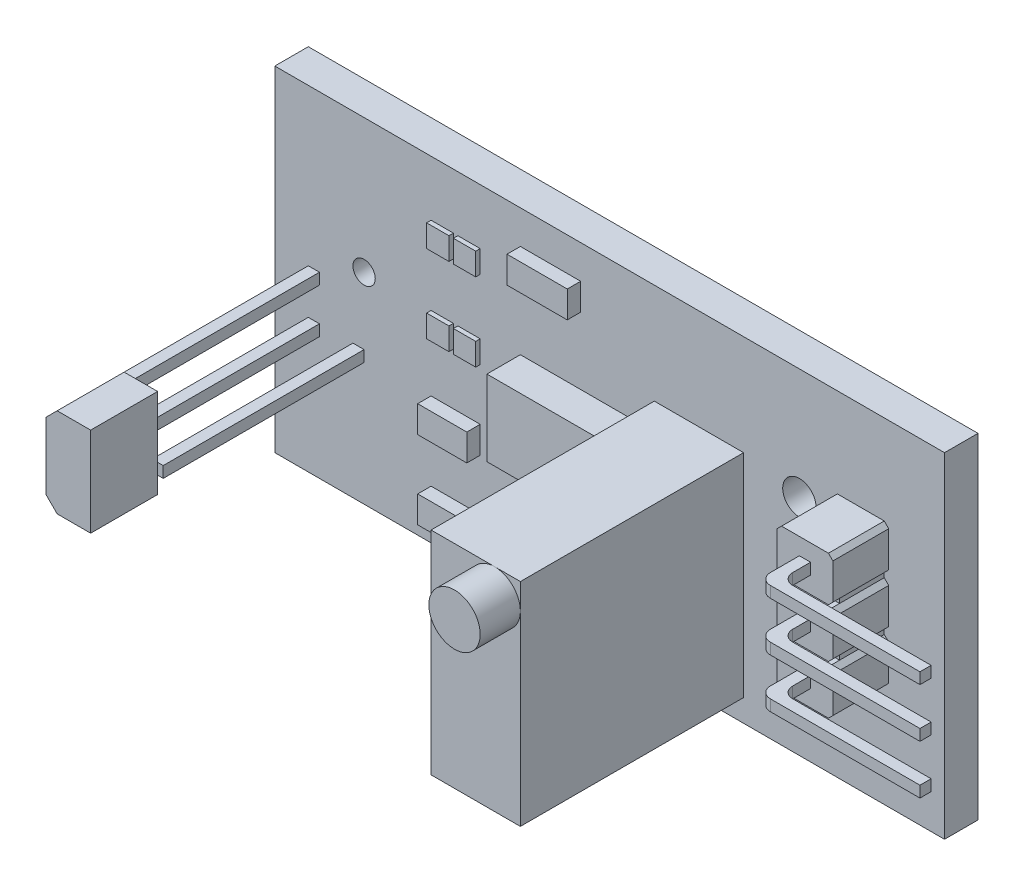
from build123d import *

# Parameters (mm, degrees)
SKETCH_1_W          = 30
SKETCH_1_H          = 15
EXTRUDE_1_DEPTH     = 1.5
SKETCH_2_W          = 4
SKETCH_2_H          = 9.5
EXTRUDE_2_DEPTH     = 10
SKETCH_3_R          = 1.15
EXTRUDE_3_DEPTH     = 1.8
SKETCH_5_W          = 2.5
SKETCH_5_H          = 2
EXTRUDE_4_DEPTH     = 2.5
CHAMFER_1_SIZE      = 0.2
SKETCH_6_W          = 2.1
SKETCH_6_H          = 0.2
EXTRUDE_5_DEPTH     = 2
SKETCH_7_W          = 0.5
SKETCH_7_H          = 0.5
EXTRUDE_6_DEPTH     = 1.8
SKETCH_8_W          = 0.5
SKETCH_8_H          = 0.5
EXTRUDE_7_DEPTH     = 6.7
FILLET_1_R          = 0.5
SKETCH_10_R         = 0.747999162
CUT_EXTRUDE_1_DEPTH = 39.294647146
SKETCH_11_W         = 5
SKETCH_11_H         = 3.4
EXTRUDE_8_DEPTH     = 1.5
SKETCH_12_W         = 2.7
SKETCH_12_H         = 1.2
EXTRUDE_9_DEPTH     = 0.6
SKETCH_13_W         = 1.6
SKETCH_13_H         = 1.3
EXTRUDE_10_DEPTH    = 1
SKETCH_14_W         = 1
SKETCH_14_H         = 1
EXTRUDE_11_DEPTH    = 0.2
SKETCH_15_W         = 2.2
SKETCH_15_H         = 1.2
EXTRUDE_12_DEPTH    = 0.6
SKETCH_17_R         = 0.5
CUT_EXTRUDE_2_DEPTH = 39.294647146
SKETCH_18_W         = 0.5
SKETCH_18_H         = 0.5
EXTRUDE_13_DEPTH    = 9
SKETCH_20_W         = 2
SKETCH_20_H         = 4
EXTRUDE_14_DEPTH    = 3
CHAMFER_2_SIZE      = 0.5


with BuildPart() as part:
    # 草图1 → 凸台-拉伸1 (new body)
    with BuildSketch(Plane.XY):
        with Locations((15, 7.5)):
            Rectangle(SKETCH_1_W, SKETCH_1_H)
    extrude(amount=EXTRUDE_1_DEPTH)

    # 草图2 → 凸台-拉伸2 (add)
    with BuildSketch(Plane.XY.offset(1.5)):
        with Locations((19, 5.75)):
            Rectangle(SKETCH_2_W, SKETCH_2_H)
    extrude(amount=EXTRUDE_2_DEPTH)

    # 草图3 → 凸台-拉伸3 (add)
    with BuildSketch(Plane.XY.offset(11.5)):
        with Locations((19.85, 9.35)):
            Circle(SKETCH_3_R)
    extrude(amount=EXTRUDE_3_DEPTH)

    # 草图5 → 凸台-拉伸4 (add)
    with BuildSketch(Plane.XY.offset(1.5)):
        with Locations((26.25, 10)):
            Rectangle(SKETCH_5_W, SKETCH_5_H)
        with Locations((26.25, 7.8)):
            Rectangle(SKETCH_5_W, SKETCH_5_H)
        with Locations((26.25, 5.6)):
            Rectangle(SKETCH_5_W, SKETCH_5_H)
    extrude(amount=EXTRUDE_4_DEPTH)

    # 倒角1
    chamfer_1_edges = [part.edges().sort_by_distance(p)[0] for p in [
        (25, 11, 2.75),
        (25, 9, 2.75),
        (27.5, 9, 2.75),
        (27.5, 11, 2.75),
        (27.5, 8.8, 2.75),
        (25, 8.8, 2.75),
        (25, 6.8, 2.75),
        (27.5, 6.8, 2.75),
        (27.5, 6.6, 2.75),
        (25, 6.6, 2.75),
        (25, 4.6, 2.75),
        (27.5, 4.6, 2.75),
    ]]
    chamfer(chamfer_1_edges, length=CHAMFER_1_SIZE)

    # 草图6 → 凸台-拉伸5 (add)
    with BuildSketch(Plane.XY.offset(1.5)):
        with Locations((26.25, 8.9)):
            Rectangle(SKETCH_6_W, SKETCH_6_H)
        with Locations((26.25, 6.7)):
            Rectangle(SKETCH_6_W, SKETCH_6_H)
    extrude(amount=EXTRUDE_5_DEPTH)

    # 草图7 → 凸台-拉伸6 (add)
    with BuildSketch(Plane.XY.offset(4)):
        with Locations((26.25, 5.6)):
            Rectangle(SKETCH_7_W, SKETCH_7_H)
        with Locations((26.25, 7.8)):
            Rectangle(SKETCH_7_W, SKETCH_7_H)
        with Locations((26.25, 10)):
            Rectangle(SKETCH_7_W, SKETCH_7_H)
    extrude(amount=EXTRUDE_6_DEPTH)

    # 草图8 → 凸台-拉伸7 (add)
    with BuildSketch(Plane(origin=(26.5, 0, 0), x_dir=(0, 0, -1), z_dir=(1, 0, 0))):
        with Locations((-5.55, 5.6)):
            Rectangle(SKETCH_8_W, SKETCH_8_H)
        with Locations((-5.55, 7.8)):
            Rectangle(SKETCH_8_W, SKETCH_8_H)
        with Locations((-5.55, 10)):
            Rectangle(SKETCH_8_W, SKETCH_8_H)
    extrude(amount=EXTRUDE_7_DEPTH)

    # 圆角1
    fillet_1_edges = [part.edges().sort_by_distance(p)[0] for p in [
        (26, 5.6, 5.8),
        (26, 7.8, 5.8),
        (26, 10, 5.8),
        (26.5, 5.6, 5.3),
        (26.5, 7.8, 5.3),
        (26.5, 10, 5.3),
    ]]
    fillet(fillet_1_edges, radius=FILLET_1_R)

    # 草图10 → 切除-拉伸1 (cut, through all)
    with BuildSketch(Plane.XY.offset(1.5)):
        with Locations((23.5, 10)):
            Circle(SKETCH_10_R)
        with Locations((23.5, 7.8)):
            Circle(SKETCH_10_R)
        with Locations((23.5, 5.6)):
            Circle(SKETCH_10_R)
    extrude(amount=-CUT_EXTRUDE_1_DEPTH, mode=Mode.SUBTRACT)

    # 草图11 → 凸台-拉伸8 (add)
    with BuildSketch(Plane.XY.offset(1.5)):
        with Locations((13.5, 7.6)):
            Rectangle(SKETCH_11_W, SKETCH_11_H)
    extrude(amount=EXTRUDE_8_DEPTH)

    # 草图12 → 凸台-拉伸9 (add)
    with BuildSketch(Plane.XY.offset(1.5)):
        with Locations((12.35, 12.9)):
            Rectangle(SKETCH_12_W, SKETCH_12_H)
    extrude(amount=EXTRUDE_9_DEPTH)

    # 草图13 → 凸台-拉伸10 (add)
    with BuildSketch(Plane.XY.offset(1.5)):
        with Locations((11.8, 1.65)):
            Rectangle(SKETCH_13_W, SKETCH_13_H)
    extrude(amount=EXTRUDE_10_DEPTH)

    # 草图14 → 凸台-拉伸11 (add)
    with BuildSketch(Plane.XY.offset(1.5)):
        with Locations((7.5, 12.016968403)):
            Rectangle(SKETCH_14_W, SKETCH_14_H)
        with Locations((8.7, 12.016968403)):
            Rectangle(SKETCH_14_W, SKETCH_14_H)
        with Locations((8.7, 8.516968403)):
            Rectangle(SKETCH_14_W, SKETCH_14_H)
        with Locations((7.5, 8.516968403)):
            Rectangle(SKETCH_14_W, SKETCH_14_H)
    extrude(amount=EXTRUDE_11_DEPTH)

    # 草图15 → 凸台-拉伸12 (add)
    with BuildSketch(Plane.XY.offset(1.5)):
        with Locations((8.1, 5.1)):
            Rectangle(SKETCH_15_W, SKETCH_15_H)
        with Locations((8.1, 1.6)):
            Rectangle(SKETCH_15_W, SKETCH_15_H)
    extrude(amount=EXTRUDE_12_DEPTH)

    # 草图17 → 切除-拉伸2 (cut, through all)
    with BuildSketch(Plane.XY.offset(1.5)):
        with Locations((4, 9)):
            Circle(SKETCH_17_R)
    extrude(amount=-CUT_EXTRUDE_2_DEPTH, mode=Mode.SUBTRACT)

    # 草图18 → 凸台-拉伸13 (add)
    with BuildSketch(Plane.XY.offset(1.5)):
        with Locations((3.75, 5.75)):
            Rectangle(SKETCH_18_W, SKETCH_18_H)
        with Locations((1.75, 7.75)):
            Rectangle(SKETCH_18_W, SKETCH_18_H)
        with Locations((1.75, 5.75)):
            Rectangle(SKETCH_18_W, SKETCH_18_H)
    extrude(amount=EXTRUDE_13_DEPTH)

    # 草图20 → 凸台-拉伸14 (add)
    with BuildSketch(Plane.XY.offset(10.5)):
        with Locations((2.75, 6.75)):
            Rectangle(SKETCH_20_W, SKETCH_20_H)
    extrude(amount=EXTRUDE_14_DEPTH)

    # 倒角2
    chamfer_2_edges = [part.edges().sort_by_distance(p)[0] for p in [
        (1.75, 8.75, 12),
        (1.75, 4.75, 12),
    ]]
    chamfer(chamfer_2_edges, length=CHAMFER_2_SIZE)


solid = part.part
